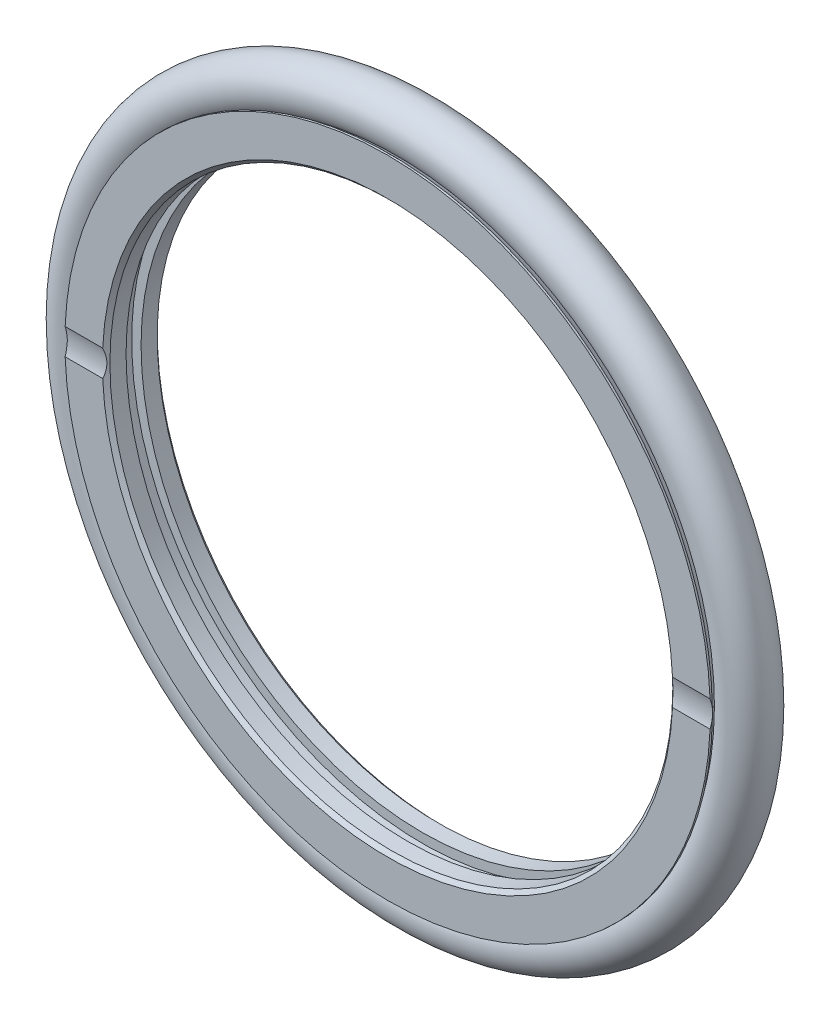
from build123d import *

# Parameters (mm, degrees)
CUT_EXTRUDE1_DEPTH      = 25.368249835
CUT_EXTRUDE1_DEPTH_BACK = 25.368249835
CUT_EXTRUDE2_DEPTH      = 25.368249911
CUT_EXTRUDE2_DEPTH_BACK = 25.368249911
SKETCH2_R               = 1.31


with BuildPart() as part:
    # Sketch1 → Revolve1 (revolve)
    with BuildSketch(Plane(origin=(0, 0, 0), x_dir=(0, 0, -1), z_dir=(1, 0, 0)), mode=Mode.PRIVATE) as revolve1_sk:
        with BuildLine():
            Line((-1.35, 17.2), (-1.46, 17.2))
            Line((-1.46, 17.2), (-1.46, 15.2))
            Line((-1.46, 15.2), (-1.26, 15))
            Line((-1.26, 15), (-0.4, 15))
            Line((-0.4, 15), (-0.4, 15.5))
            Line((-0.4, 15.5), (0.4, 15.5))
            Line((0.4, 15.5), (0.4, 15))
            Line((0.4, 15), (1.26, 15))
            Line((1.26, 15), (1.46, 15.2))
            Line((1.46, 15.2), (1.46, 17.2))
            Line((1.46, 17.2), (1.35, 17.2))
            ThreePointArc((1.35, 17.2), (0.976877948, 16.923126755), (0.522730395, 16.825))
            Line((0.522730395, 16.825), (-0.522730395, 16.825))
            ThreePointArc((-0.522730395, 16.825), (-0.976877948, 16.923126755), (-1.35, 17.2))
        make_face()
    revolve(revolve1_sk.sketch.rotate(Axis((0, 0, 0), (0, 0, -1)), 90), axis=Axis((0, 0, 0), (0, 0, -1)))

    # Sketch3 → Cut-Extrude1 (cut, two sides: drawn at the far end of the back side and taken through both)
    with BuildSketch(Plane(origin=(0, 0, 0), x_dir=(1, 0, 0), z_dir=(0, 1, 0)).offset(-CUT_EXTRUDE1_DEPTH_BACK)):
        with BuildLine():
            Line((-0.7, 1.46), (0.7, 1.46))
            ThreePointArc((0.7, 1.46), (0, 1.34), (-0.7, 1.46))
        make_face()
    extrude(amount=CUT_EXTRUDE1_DEPTH + CUT_EXTRUDE1_DEPTH_BACK, mode=Mode.SUBTRACT)

    # Sketch4 → Cut-Extrude2 (cut, two sides: drawn at the far end of the back side and taken through both)
    with BuildSketch(Plane(origin=(0, 0, 0), x_dir=(0, 0, -1), z_dir=(1, 0, 0)).offset(-CUT_EXTRUDE2_DEPTH_BACK)):
        with BuildLine():
            Line((-1.46, 0.7), (-1.46, -0.7))
            ThreePointArc((-1.46, -0.7), (-1.34, 0), (-1.46, 0.7))
        make_face()
    extrude(amount=CUT_EXTRUDE2_DEPTH + CUT_EXTRUDE2_DEPTH_BACK, mode=Mode.SUBTRACT)


with BuildPart() as body_2:
    # Sketch2 → Revolve2 (revolve)
    with BuildSketch(Plane(origin=(0, 0, 0), x_dir=(0, 0, -1), z_dir=(1, 0, 0)), mode=Mode.PRIVATE) as revolve2_sk:
        with Locations((0, 17.805)):
            Circle(SKETCH2_R)
    revolve(revolve2_sk.sketch.rotate(Axis((0, 0, 0), (0, 0, -1)), 182.639555001), axis=Axis((0, 0, 0), (0, 0, -1)))


solid = Compound([part.part, body_2.part])
